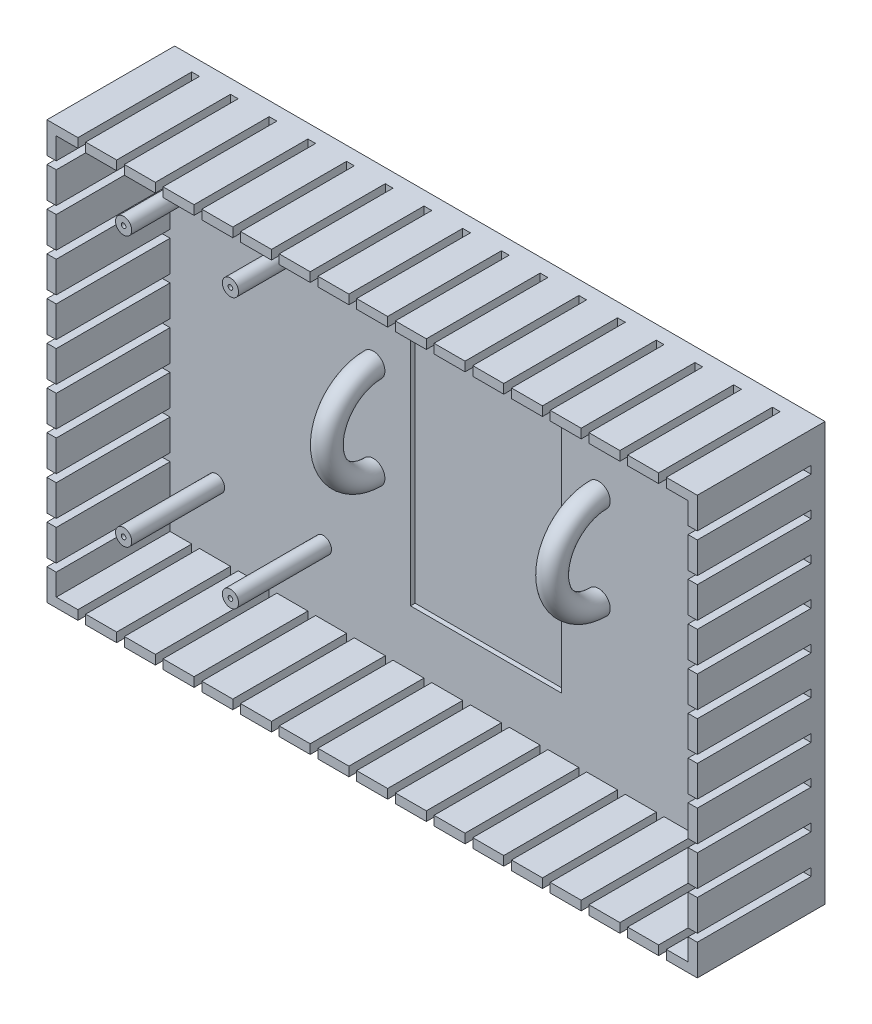
from build123d import *

# Parameters (mm, degrees)
SKETCH1_W           = 90
SKETCH1_H           = 140
BOSS_EXTRUDE1_DEPTH = 3
SKETCH2_W           = 32.5
SKETCH2_H           = 62
CUT_EXTRUDE1_DEPTH  = 1
SKETCH6_R           = 1.75
SKETCH6_R_2         = 0.5
BOSS_EXTRUDE2_DEPTH = 20
SKETCH6_3_R         = 0.5
BOSS_EXTRUDE3_DEPTH = 19
SKETCH7_W           = 6.666666667
SKETCH7_H           = 2
SKETCH7_W_2         = 6.666666666
SKETCH7_W_3         = 2
SKETCH7_H_2         = 6.666666667
SKETCH7_H_3         = 6.666666666
BOSS_EXTRUDE6_DEPTH = 24.5
SKETCH9_R           = 2.5
REVOLVE3_ANGLE      = 180


with BuildPart() as part:
    # Sketch1 → Boss-Extrude1 (new body)
    with BuildSketch(Plane(origin=(0, 0, 0), x_dir=(0, 1, 0), z_dir=(0, 0, 1))):
        Rectangle(SKETCH1_W, SKETCH1_H)
    extrude(amount=BOSS_EXTRUDE1_DEPTH)

    # Sketch2 → Cut-Extrude1 (cut)
    with BuildSketch(Plane.XY.offset(3)):
        Rectangle(SKETCH2_W, SKETCH2_H)
    extrude(amount=-CUT_EXTRUDE1_DEPTH, mode=Mode.SUBTRACT)

    # Sketch6 → Boss-Extrude2 (add)
    # profile 1 of 4: a face of its own
    with BuildSketch(Plane.XY.offset(3)):
        with Locations((-58, 29)):
            Circle(SKETCH6_R)
        with Locations((-58, 29)):
            Circle(SKETCH6_R_2, mode=Mode.SUBTRACT)
    # profile 2 of 4: a face of its own
    with BuildSketch(Plane.XY.offset(3)):
        with Locations((-35, 29)):
            Circle(SKETCH6_R)
        with Locations((-35, 29)):
            Circle(SKETCH6_R_2, mode=Mode.SUBTRACT)
    # profile 3 of 4: a face of its own
    with BuildSketch(Plane.XY.offset(3)):
        with Locations((-35, -29)):
            Circle(SKETCH6_R)
        with Locations((-35, -29)):
            Circle(SKETCH6_R_2, mode=Mode.SUBTRACT)
    # profile 4 of 4: a face of its own
    with BuildSketch(Plane.XY.offset(3)):
        with Locations((-58, -29)):
            Circle(SKETCH6_R)
        with Locations((-58, -29)):
            Circle(SKETCH6_R_2, mode=Mode.SUBTRACT)
    extrude(amount=BOSS_EXTRUDE2_DEPTH)

    # Sketch6<3> → Boss-Extrude3 (add)
    with BuildSketch(Plane.XY.offset(3)):
        with Locations((-58, 29)):
            Circle(SKETCH6_3_R)
        with Locations((-35, 29)):
            Circle(SKETCH6_3_R)
        with Locations((-58, -29)):
            Circle(SKETCH6_3_R)
        with Locations((-35, -29)):
            Circle(SKETCH6_3_R)
    extrude(amount=BOSS_EXTRUDE3_DEPTH)

    # Sketch7 → Boss-Extrude6 (add)
    with BuildSketch(Plane.XY.offset(3)):
        with Locations((-58.333333334, 44)):
            Rectangle(SKETCH7_W, SKETCH7_H)
        Polygon((-63.333333333, 43), (-63.333333333, 45), (-70, 45), (-70, 38.333333333), (-68, 38.333333333), (-68, 43), align=None)
        with Locations((-50, 44)):
            Rectangle(SKETCH7_W_2, SKETCH7_H)
        with Locations((-41.666666667, 44)):
            Rectangle(SKETCH7_W, SKETCH7_H)
        with Locations((-33.333333334, 44)):
            Rectangle(SKETCH7_W, SKETCH7_H)
        with Locations((-69, 33.333333334)):
            Rectangle(SKETCH7_W_3, SKETCH7_H_2)
        with Locations((-25, 44)):
            Rectangle(SKETCH7_W_2, SKETCH7_H)
        with Locations((-69, 25)):
            Rectangle(SKETCH7_W_3, SKETCH7_H_3)
        with Locations((-16.666666666, 44)):
            Rectangle(SKETCH7_W, SKETCH7_H)
        with Locations((-69, 16.666666666)):
            Rectangle(SKETCH7_W_3, SKETCH7_H_2)
        with Locations((-8.333333334, 44)):
            Rectangle(SKETCH7_W, SKETCH7_H)
        with Locations((-69, 8.333333334)):
            Rectangle(SKETCH7_W_3, SKETCH7_H_2)
        with Locations((0, 44)):
            Rectangle(SKETCH7_W_2, SKETCH7_H)
        with Locations((-69, 0)):
            Rectangle(SKETCH7_W_3, SKETCH7_H_3)
        with Locations((8.333333334, 44)):
            Rectangle(SKETCH7_W, SKETCH7_H)
        with Locations((-69, -8.333333334)):
            Rectangle(SKETCH7_W_3, SKETCH7_H_2)
        with Locations((16.666666666, 44)):
            Rectangle(SKETCH7_W, SKETCH7_H)
        with Locations((-69, -16.666666666)):
            Rectangle(SKETCH7_W_3, SKETCH7_H_2)
        with Locations((25, 44)):
            Rectangle(SKETCH7_W_2, SKETCH7_H)
        with Locations((-69, -25)):
            Rectangle(SKETCH7_W_3, SKETCH7_H_3)
        with Locations((33.333333334, 44)):
            Rectangle(SKETCH7_W, SKETCH7_H)
        with Locations((-69, -33.333333334)):
            Rectangle(SKETCH7_W_3, SKETCH7_H_2)
        with Locations((41.666666667, 44)):
            Rectangle(SKETCH7_W, SKETCH7_H)
        Polygon((-68, -38.333333333), (-70, -38.333333333), (-70, -45), (-63.333333333, -45), (-63.333333333, -43), (-68, -43), align=None)
        with Locations((50, 44)):
            Rectangle(SKETCH7_W_2, SKETCH7_H)
        with Locations((58.333333334, 44)):
            Rectangle(SKETCH7_W, SKETCH7_H)
        with Locations((-58.333333334, -44)):
            Rectangle(SKETCH7_W, SKETCH7_H)
        Polygon((63.333333333, 45), (63.333333333, 43), (68, 43), (68, 38.333333333), (70, 38.333333333), (70, 45), align=None)
        with Locations((-50, -44)):
            Rectangle(SKETCH7_W_2, SKETCH7_H)
        with Locations((-41.666666667, -44)):
            Rectangle(SKETCH7_W, SKETCH7_H)
        with Locations((69, 33.333333334)):
            Rectangle(SKETCH7_W_3, SKETCH7_H_2)
        with Locations((-33.333333334, -44)):
            Rectangle(SKETCH7_W, SKETCH7_H)
        with Locations((69, 25)):
            Rectangle(SKETCH7_W_3, SKETCH7_H_3)
        with Locations((-25, -44)):
            Rectangle(SKETCH7_W_2, SKETCH7_H)
        with Locations((69, 16.666666666)):
            Rectangle(SKETCH7_W_3, SKETCH7_H_2)
        with Locations((-16.666666666, -44)):
            Rectangle(SKETCH7_W, SKETCH7_H)
        with Locations((69, 8.333333334)):
            Rectangle(SKETCH7_W_3, SKETCH7_H_2)
        with Locations((-8.333333334, -44)):
            Rectangle(SKETCH7_W, SKETCH7_H)
        with Locations((69, 0)):
            Rectangle(SKETCH7_W_3, SKETCH7_H_3)
        with Locations((0, -44)):
            Rectangle(SKETCH7_W_2, SKETCH7_H)
        with Locations((69, -8.333333334)):
            Rectangle(SKETCH7_W_3, SKETCH7_H_2)
        with Locations((8.333333334, -44)):
            Rectangle(SKETCH7_W, SKETCH7_H)
        with Locations((69, -16.666666666)):
            Rectangle(SKETCH7_W_3, SKETCH7_H_2)
        with Locations((16.666666666, -44)):
            Rectangle(SKETCH7_W, SKETCH7_H)
        with Locations((69, -25)):
            Rectangle(SKETCH7_W_3, SKETCH7_H_3)
        with Locations((25, -44)):
            Rectangle(SKETCH7_W_2, SKETCH7_H)
        with Locations((69, -33.333333334)):
            Rectangle(SKETCH7_W_3, SKETCH7_H_2)
        with Locations((33.333333334, -44)):
            Rectangle(SKETCH7_W, SKETCH7_H)
        Polygon((70, -38.333333333), (68, -38.333333333), (68, -43), (63.333333333, -43), (63.333333333, -45), (70, -45), align=None)
        with Locations((41.666666667, -44)):
            Rectangle(SKETCH7_W, SKETCH7_H)
        with Locations((50, -44)):
            Rectangle(SKETCH7_W_2, SKETCH7_H)
        with Locations((58.333333334, -44)):
            Rectangle(SKETCH7_W, SKETCH7_H)
    extrude(amount=BOSS_EXTRUDE6_DEPTH)

    # Sketch9 → Revolve3 (revolve)
    with BuildSketch(Plane.XY.offset(3)):
        with Locations((-24.25, -10)):
            Circle(SKETCH9_R)
        with Locations((24.25, -10)):
            Circle(SKETCH9_R)
    revolve(axis=Axis((-36.309330937, 0, 3), (-1, 0, 0)), revolution_arc=REVOLVE3_ANGLE)


solid = part.part
